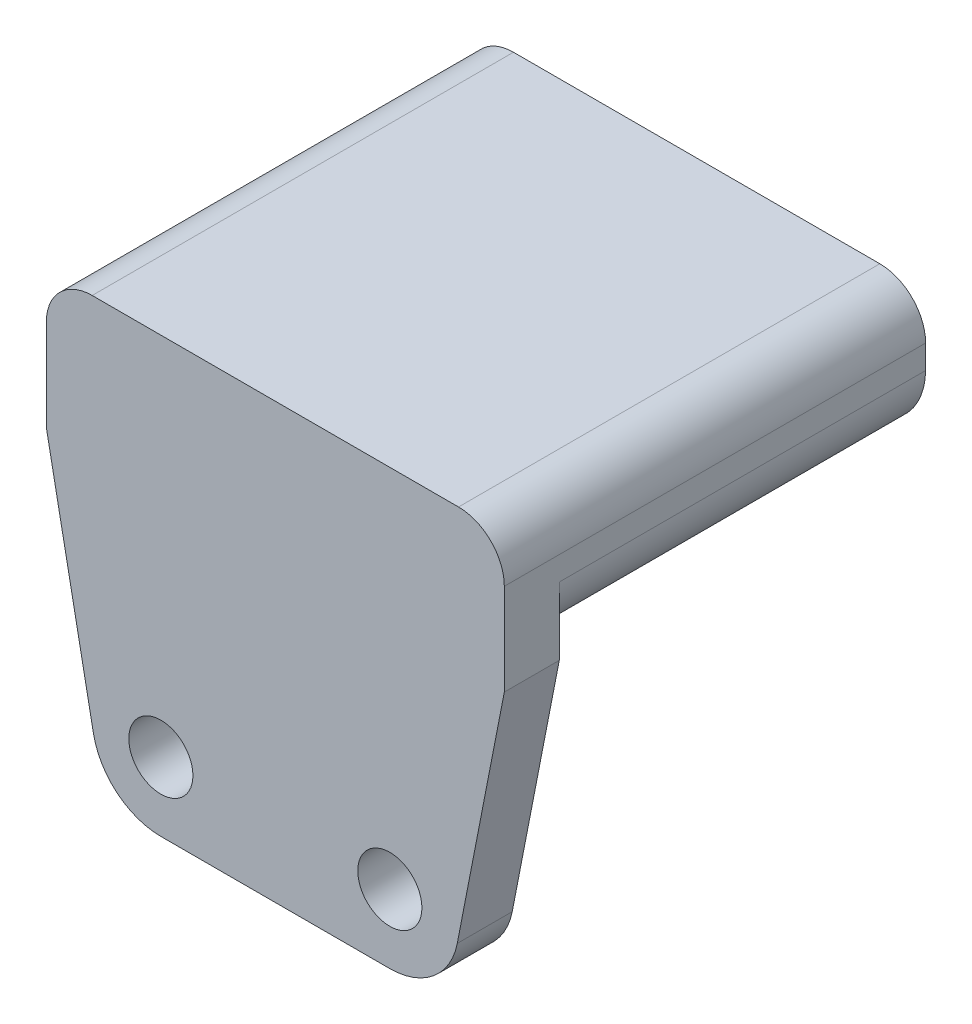
from build123d import *

# Parameters (mm, degrees)
SKETCH_1_R      = 3.5
EXTRUDE_1_DEPTH = 6
EXTRUDE_START   = -40
EXTRUDE_2_DEPTH = 40


with BuildPart() as part:
    # 草图1 → 凸台-拉伸1 (new body)
    with BuildSketch(Plane.XY):
        with BuildLine():
            ThreePointArc((-19.861209285, -1.436174734), (-17.268578902, -5.788838852), (-12.5, -7.5))
            Line((-12.5, -7.5), (12.5, -7.5))
            ThreePointArc((12.5, -7.5), (17.268578902, -5.788838852), (19.861209285, -1.436174734))
            Line((19.861209285, -1.436174734), (25, 24.903039453))
            Line((25, 24.903039453), (25, 34.903039453))
            ThreePointArc((25, 34.903039453), (23.535533906, 38.438573359), (20, 39.903039453))
            Line((20, 39.903039453), (-20, 39.903039453))
            ThreePointArc((-20, 39.903039453), (-23.535533906, 38.438573359), (-25, 34.903039453))
            Line((-25, 34.903039453), (-25, 24.903039453))
            Line((-25, 24.903039453), (-19.861209285, -1.436174734))
        make_face()
        with Locations((-12.5, 0)):
            Circle(SKETCH_1_R, mode=Mode.SUBTRACT)
        with Locations((12.5, 0)):
            Circle(SKETCH_1_R, mode=Mode.SUBTRACT)
    extrude(amount=EXTRUDE_1_DEPTH)

    # 草图1<6> → 凸台-拉伸2 (add)
    with BuildSketch(Plane.XY.offset(EXTRUDE_START)):
        with BuildLine():
            Line((-25, 34.903039453), (-25, 32.403039453))
            ThreePointArc((-25, 32.403039453), (-22.803300859, 27.099738594), (-17.5, 24.903039453))
            Line((-17.5, 24.903039453), (17.5, 24.903039453))
            ThreePointArc((17.5, 24.903039453), (22.769312351, 27.065347755), (25, 32.306078854))
            Line((25, 32.306078854), (25, 32.5))
            Line((25, 32.5), (25, 34.903039453))
            ThreePointArc((25, 34.903039453), (23.535533906, 38.438573359), (20, 39.903039453))
            Line((20, 39.903039453), (-20, 39.903039453))
            ThreePointArc((-20, 39.903039453), (-23.535533906, 38.438573359), (-25, 34.903039453))
        make_face()
    extrude(amount=EXTRUDE_2_DEPTH)


solid = part.part
